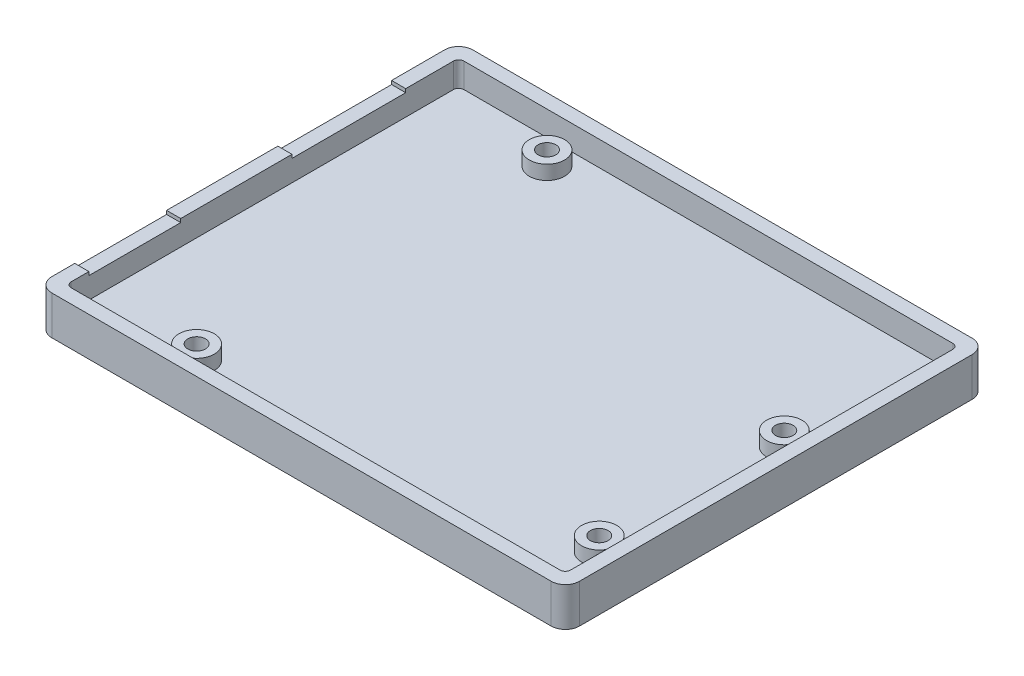
from build123d import *

# Parameters (mm, degrees)
BOSS_EXTRUDE1_START       = -2
SKETCH2_W                 = 74.7
SKETCH2_H                 = 59.6
BOSS_EXTRUDE1_DEPTH       = 2
BOSS_EXTRUDE2_START       = -2
SKETCH3_W                 = 74.7
SKETCH3_H                 = 59.6
SKETCH3_W_2               = 70.7
SKETCH3_H_2               = 55.6
BOSS_EXTRUDE2_DEPTH       = 3.5
BOSS_EXTRUDE3_START       = -4
SKETCH4_R                 = 2.5
BOSS_EXTRUDE3_DEPTH       = 4
M3X0_5_TAPPED_HOLE2_D     = 2.5
M3X0_5_TAPPED_HOLE2_DEPTH = 2.5
M3X0_5_TAPPED_HOLE2_TIP   = 0.751075774
FILLET1_R                 = 0.75
FILLET2_R                 = 2
SKETCH15_W                = 2
SKETCH15_H                = 13
SKETCH15_H_2              = 16.1
CUT_EXTRUDE1_DEPTH        = 0.5


with BuildPart() as part:
    # Sketch2 → Boss-Extrude1 (new body)
    with BuildSketch(Plane(origin=(0, 0, 0), x_dir=(1, 0, 0), z_dir=(0, 1, 0)).offset(BOSS_EXTRUDE1_START)):
        with Locations((34.35, 26.8)):
            Rectangle(SKETCH2_W, SKETCH2_H)
    extrude(amount=-BOSS_EXTRUDE1_DEPTH)

    # Sketch3 → Boss-Extrude2 (add)
    with BuildSketch(Plane(origin=(0, 0, 0), x_dir=(1, 0, 0), z_dir=(0, 1, 0)).offset(BOSS_EXTRUDE2_START)):
        with Locations((34.35, 26.8)):
            Rectangle(SKETCH3_W, SKETCH3_H)
        with Locations((34.35, 26.8)):
            Rectangle(SKETCH3_W_2, SKETCH3_H_2, mode=Mode.SUBTRACT)
    extrude(amount=BOSS_EXTRUDE2_DEPTH)

    # Sketch4 → Boss-Extrude3 (add)
    with BuildSketch(Plane(origin=(0, 0, 0), x_dir=(1, 0, 0), z_dir=(0, 1, 0)).offset(BOSS_EXTRUDE3_START)):
        with Locations(Location((14, 2.5, 0), (0, 0, 270))):
            Circle(SKETCH4_R)
        with Locations(Location((15, 51.1, 0), (0, 0, 270))):
            Circle(SKETCH4_R)
        with Locations(Location((66.2, 33.5, 0), (0, 0, 270))):
            Circle(SKETCH4_R)
        with Locations(Location((66, 7.5, 0), (0, 0, 270))):
            Circle(SKETCH4_R)
    extrude(amount=BOSS_EXTRUDE3_DEPTH)

    # M3x0.5 Tapped Hole2
    with Locations(Plane(origin=(66, 0, -7.5), x_dir=(0, 0, 1), z_dir=(0, 1, 0))):
        with Locations((0, 0), (-26, 0.2), (-43.6, -51), (5, -52)):
            Hole(M3X0_5_TAPPED_HOLE2_D / 2, depth=M3X0_5_TAPPED_HOLE2_DEPTH)
            with Locations((0, 0, -(M3X0_5_TAPPED_HOLE2_DEPTH + M3X0_5_TAPPED_HOLE2_TIP / 2))):  # 118° drill point
                Cone(0, M3X0_5_TAPPED_HOLE2_D / 2, M3X0_5_TAPPED_HOLE2_TIP, mode=Mode.SUBTRACT)

    # Fillet1
    fillet1_edges = [part.edges().sort_by_distance(p)[0] for p in [
        (-1, -0.25, 1),
        (-1, -0.25, -54.6),
        (69.7, -0.25, -54.6),
        (69.7, -0.25, 1),
    ]]
    fillet(fillet1_edges, radius=FILLET1_R)

    # Fillet2
    fillet2_edges = [part.edges().sort_by_distance(p)[0] for p in [
        (71.7, -1.25, -56.6),
        (71.7, -1.25, 3),
        (-3, -1.25, 3),
        (-3, -1.25, -56.6),
    ]]
    fillet(fillet2_edges, radius=FILLET2_R)

    # Sketch15 → Cut-Extrude1 (cut)
    with BuildSketch(Plane(origin=(0, 1.5, 0), x_dir=(1, 0, 0), z_dir=(0, 1, 0))):
        with Locations((-2, 8.75)):
            Rectangle(SKETCH15_W, SKETCH15_H)
        with Locations((-2, 39.05)):
            Rectangle(SKETCH15_W, SKETCH15_H_2)
    extrude(amount=-CUT_EXTRUDE1_DEPTH, mode=Mode.SUBTRACT)


solid = part.part
